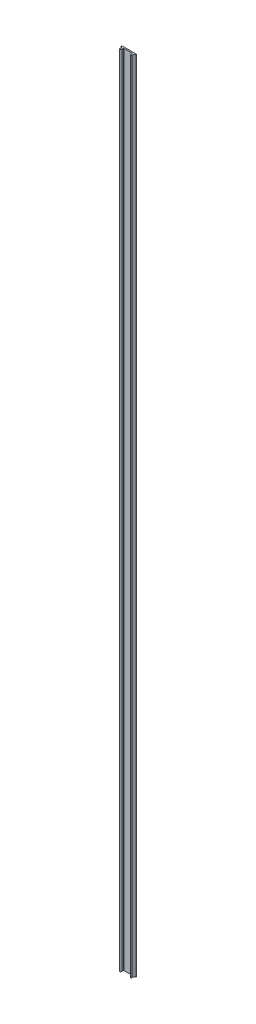
from build123d import *

# Parameters (mm, degrees)
PROFILE_EXTRUDE_DEPTH = 500


with BuildPart() as part:
    # Profile Sketch → Profile Extrude (new body)
    with BuildSketch(Plane(origin=(0, 0, 0), x_dir=(1, 0, 0), z_dir=(0, 1, 0))):
        with BuildLine():
            Line((0, 0.762), (4.235793346, 0.762))
            ThreePointArc((4.235793346, 0.762), (4.559082566, 0.62808922), (4.692993346, 0.3048))
            ThreePointArc((4.692993346, 0.3048), (3.844388962, -0.212390939), (3.748927066, -1.20158399))
            ThreePointArc((3.748927066, -1.20158399), (3.415292673, -1.798270502), (2.889593346, -1.36125))
            Line((2.889593346, -1.36125), (2.889593346, -0.4572))
            ThreePointArc((2.889593346, -0.4572), (2.755682566, -0.13391078), (2.432393346, 0))
            Line((2.432393346, 0), (0, 0))
            Line((0, 0), (0, 0.762))
        make_face()
    profile_extrude = extrude(amount=PROFILE_EXTRUDE_DEPTH)

    # Profile Mirror: Profile Extrude across plane
    add(profile_extrude.mirror(Plane(origin=(0, 0, 0), x_dir=(0, 0, 1), z_dir=(1, 0, 0))))


solid = part.part
